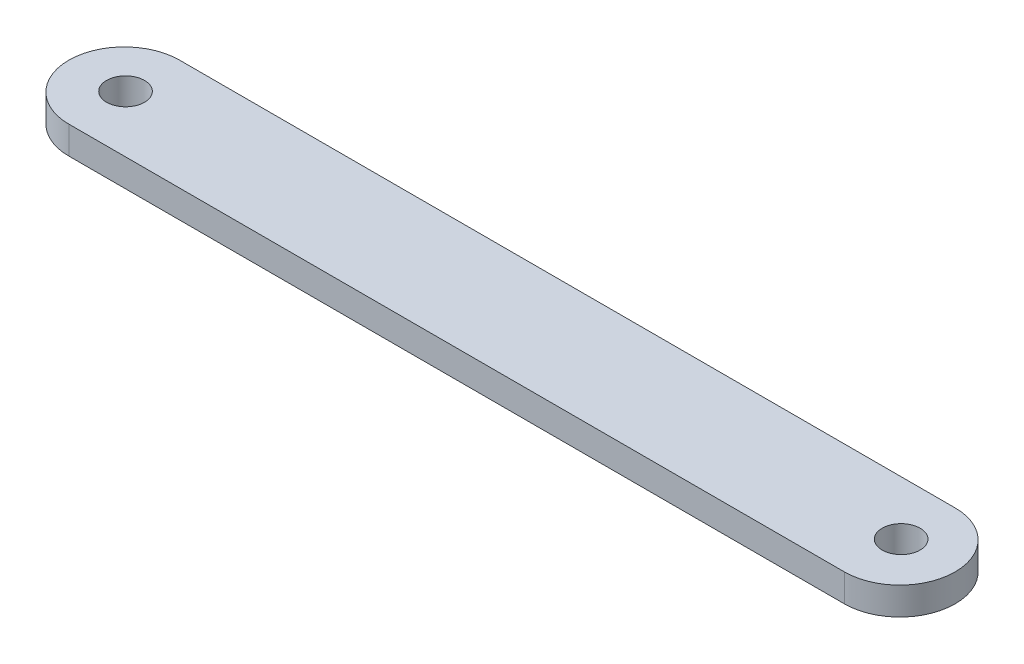
from build123d import *

# Parameters (mm, degrees)
BOSS_EXTRUDE1_DEPTH = 3.175
SKETCH2_R           = 2.175
CUT_EXTRUDE1_DEPTH  = 12.7


with BuildPart() as part:
    # Sketch1 → Boss-Extrude1 (new body)
    with BuildSketch(Plane(origin=(0, 0, 0), x_dir=(1, 0, 0), z_dir=(0, 1, 0))):
        with BuildLine():
            Line((-23.171929825, 5.625877193), (65.728070175, 5.625877193))
            ThreePointArc((65.728070175, 5.625877193), (72.078070175, -0.724122807), (65.728070175, -7.074122807))
            Line((65.728070175, -7.074122807), (-23.171929825, -7.074122807))
            ThreePointArc((-23.171929825, -7.074122807), (-29.521929825, -0.724122807), (-23.171929825, 5.625877193))
        make_face()
    extrude(amount=BOSS_EXTRUDE1_DEPTH)

    # Sketch2 → Cut-Extrude1 (cut)
    with BuildSketch(Plane(origin=(0, 3.175, 0), x_dir=(1, 0, 0), z_dir=(0, 1, 0))):
        with Locations(Location((-23.171929825, -0.570780949, 0), (0, 0, 270))):
            Circle(SKETCH2_R)
        with Locations(Location((65.728070175, -0.570780949, 0), (0, 0, 270))):
            Circle(SKETCH2_R)
    extrude(amount=-CUT_EXTRUDE1_DEPTH, mode=Mode.SUBTRACT)


solid = part.part
